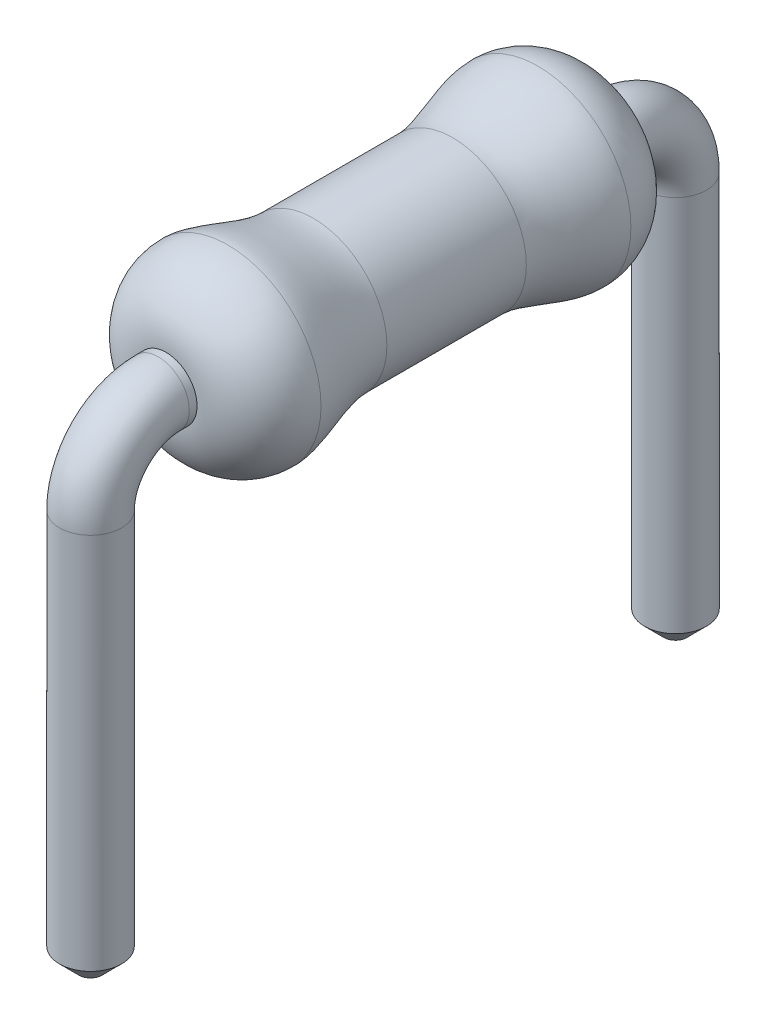
from build123d import *

# Parameters (mm, degrees)
SKETCH2_R     = 0.4
CHAMFER1_SIZE = 0.25


with BuildPart() as part:
    # Sweep1: sweep along a path in Sketch1
    with BuildLine(Plane(origin=(0, 0, 0), x_dir=(0, 0, -1), z_dir=(1, 0, 0))) as sweep1_path:
        Line((-3.775, -3), (-3.775, 2.125))
        ThreePointArc((-3.775, 2.125), (-3.518718434, 2.743718434), (-2.9, 3))
        Line((-2.9, 3), (2.9, 3))
        ThreePointArc((2.9, 3), (3.518718434, 2.743718434), (3.775, 2.125))
        Line((3.775, 2.125), (3.775, -3))
    # Sketch2 → Sweep1 (sweep)
    with BuildSketch(Plane(origin=(0, -3, 3.775), x_dir=(-1, 0, 0), z_dir=(0, -1, 0))):
        Circle(SKETCH2_R)
    sweep(path=sweep1_path.line)

    # Chamfer1
    chamfer1_edges = [part.edges().sort_by_distance(p)[0] for p in [
        (0.4, -3, 3.775),
        (0.4, -3, -3.775),
    ]]
    chamfer(chamfer1_edges, length=CHAMFER1_SIZE)


with BuildPart() as body_2:
    # Sketch4 → Revolve1 (revolve)
    with BuildSketch(Plane(origin=(0, 0, 0), x_dir=(0, 0, -1), z_dir=(1, 0, 0)), mode=Mode.PRIVATE) as revolve1_sk:
        with BuildLine():
            Line((2.8, 3.4), (-2.8, 3.4))
            ThreePointArc((-2.8, 3.4), (-2.565685425, 3.965685425), (-2, 4.2))
            add(Edge.make_bspline(
                [(-2, 4.2), (-1.738553238, 4.2), (-1.279897429, 3.95), (-0.9, 3.95)],
                knots=[0, 0, 0, 0, 1, 1, 1, 1], degree=3))
            Line((-0.9, 3.95), (0.9, 3.95))
            add(Edge.make_bspline(
                [(0.9, 3.95), (1.229757601, 3.95), (1.677489286, 4.2), (2, 4.2)],
                knots=[0, 0, 0, 0, 1, 1, 1, 1], degree=3))
            ThreePointArc((2, 4.2), (2.565685425, 3.965685425), (2.8, 3.4))
        make_face()
    revolve(revolve1_sk.sketch.rotate(Axis((0, 3, 5.508101646), (0, 0, -1)), 90), axis=Axis((0, 3, 5.508101646), (0, 0, -1)))


solid = Compound([part.part, body_2.part])
